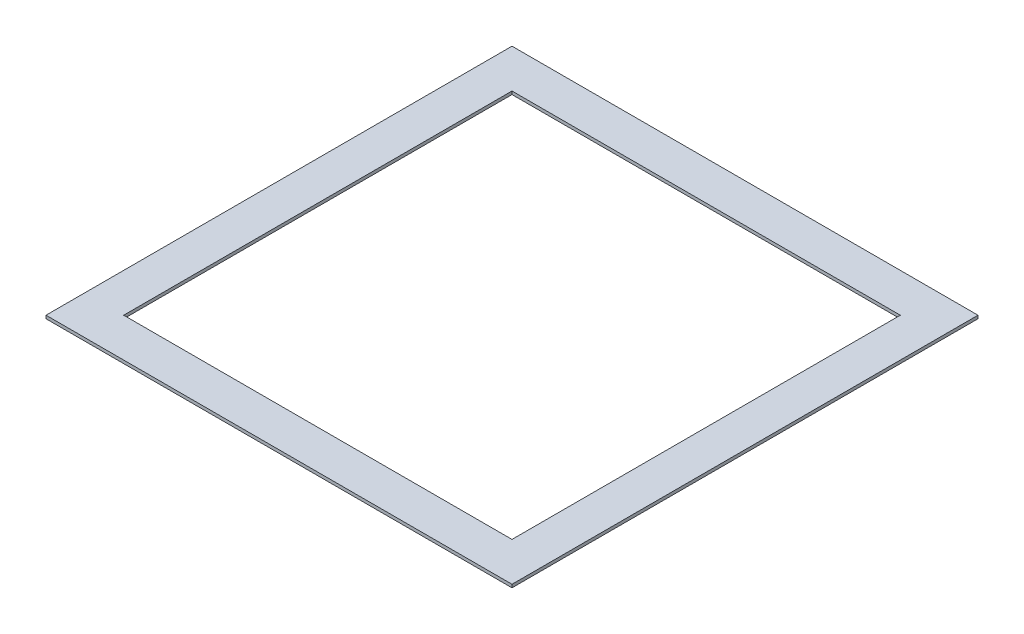
from build123d import *

# Parameters (mm, degrees)
SKETCH1_W      = 1200
SKETCH1_H      = 1200
SKETCH1_W_2    = 1000
SKETCH1_H_2    = 1000
EXTRUDE1_DEPTH = 8


with BuildPart() as part:
    # Sketch1 → Extrude1 (new body)
    with BuildSketch(Plane(origin=(0, 0, 0), x_dir=(1, 0, 0), z_dir=(0, 1, 0))):
        Rectangle(SKETCH1_W, SKETCH1_H)
        Rectangle(SKETCH1_W_2, SKETCH1_H_2, mode=Mode.SUBTRACT)
    extrude(amount=-EXTRUDE1_DEPTH)


solid = part.part
